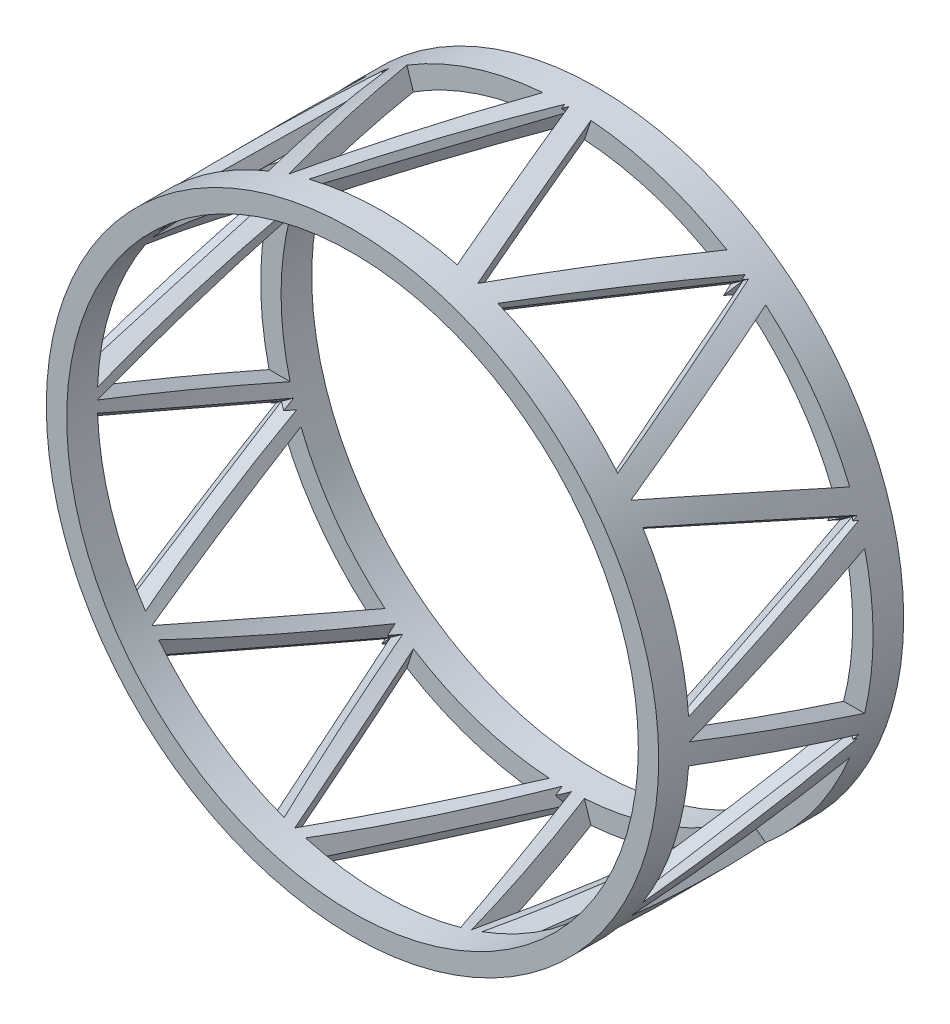
from build123d import *

# Parameters (mm, degrees)
SKETCH1_R           = 15
SKETCH1_R_2         = 14
BOSS_EXTRUDE1_DEPTH = 12
CUT_EXTRUDE1_DEPTH  = 31
CIRPATTERN1_COUNT   = 5
CUT_EXTRUDE2_DEPTH  = 32
CIRPATTERN2_COUNT   = 10


with BuildPart() as part:
    # Sketch1 → Boss-Extrude1 (new body)
    with BuildSketch(Plane.XY):
        Circle(SKETCH1_R)
        Circle(SKETCH1_R_2, mode=Mode.SUBTRACT)
    extrude(amount=BOSS_EXTRUDE1_DEPTH)

    # Sketch2 → Cut-Extrude1 (cut, symmetric)
    with BuildSketch(Plane(origin=(0, 0, 0), x_dir=(0, 0, -1), z_dir=(1, 0, 0))):
        Polygon((-1.5, 0), (-1.5, 3.5), (-10.5, 0), (-1.5, -3.5), align=None)
    cut_extrude1 = extrude(amount=CUT_EXTRUDE1_DEPTH, both=True, mode=Mode.SUBTRACT)

    # CirPattern1: Cut-Extrude1 ×5 about axis
    cirpattern1_axis = Axis((0, 0, 0), (0, 0, 1))
    for i in range(1, CIRPATTERN1_COUNT):
        add(cut_extrude1.rotate(cirpattern1_axis, i * 360 / CIRPATTERN1_COUNT), mode=Mode.SUBTRACT)

    # Sketch7 → Cut-Extrude2 (cut)
    with BuildSketch(Plane(origin=(-4.635254916, 14.265847744, 0), x_dir=(0.9510565162951501, 0.30901699437495833, 0), z_dir=(-0.30901699437495833, 0.9510565162951502, 0))):
        Polygon((-1.041848082, -10.5), (-4.541848082, -1.5), (-7.776778784, -10.5), align=None)
    cut_extrude2 = extrude(amount=-CUT_EXTRUDE2_DEPTH, mode=Mode.SUBTRACT)

    # CirPattern2: Cut-Extrude2 ×10 about axis
    cirpattern2_axis = Axis((0, 0, 0), (0, 0, 1))
    for i in range(1, CIRPATTERN2_COUNT):
        add(cut_extrude2.rotate(cirpattern2_axis, i * 360 / CIRPATTERN2_COUNT), mode=Mode.SUBTRACT)


solid = part.part
